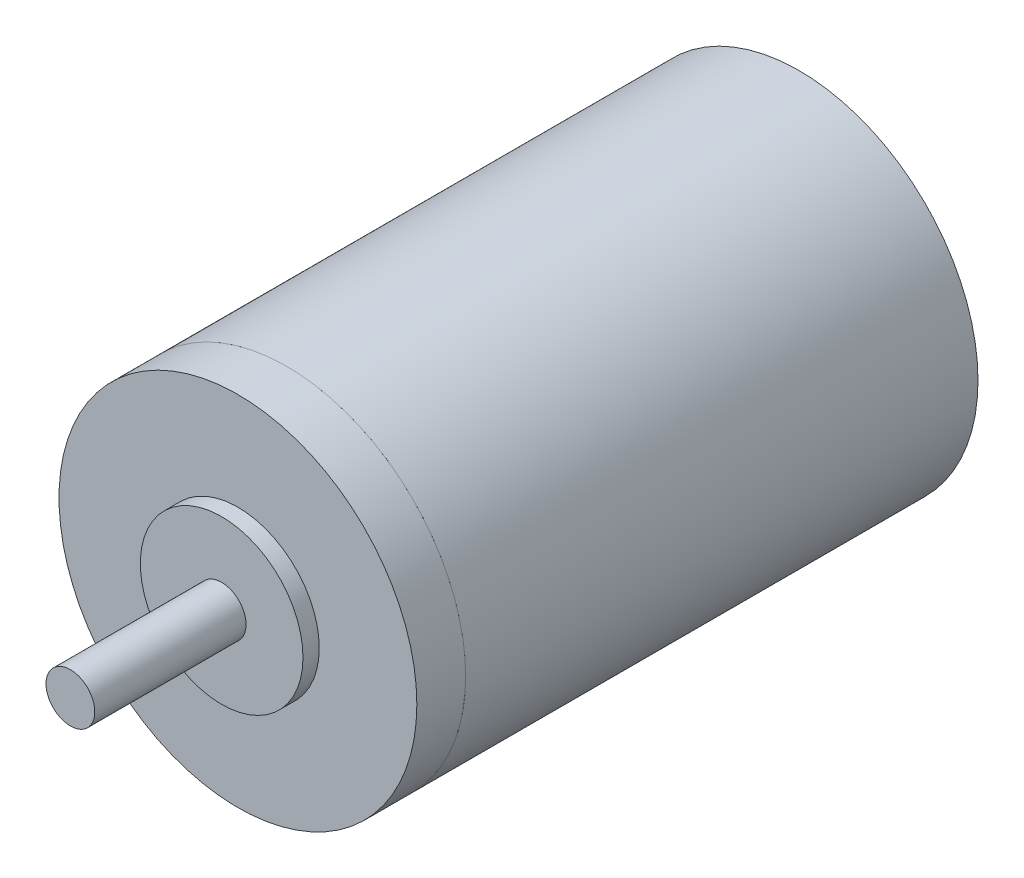
from build123d import *

# Parameters (mm, degrees)
SKETCH1_R      = 11
BODY_DEPTH     = 34.5
SKETCH1_3_R    = 5
COLLAR_DEPTH   = 1
SKETCH1_4_R    = 1.5
SHAFT_DEPTH    = 10.3
CAP_START      = -3
SKETCH2_R      = 11
SKETCH2_R_2    = 10.5
CAP_RING_DEPTH = 0.001


with BuildPart() as part:
    # Sketch1 → Body (new body)
    with BuildSketch(Plane.XY):
        Circle(SKETCH1_R)
    extrude(amount=-BODY_DEPTH)

    # Sketch1<3> → Collar (add)
    with BuildSketch(Plane.XY):
        Circle(SKETCH1_3_R)
    extrude(amount=COLLAR_DEPTH)

    # Sketch1<4> → Shaft (add)
    with BuildSketch(Plane.XY):
        Circle(SKETCH1_4_R)
    extrude(amount=SHAFT_DEPTH)

    # Sketch2 → Cap Ring (cut)
    with BuildSketch(Plane.XY.offset(CAP_START)):
        Circle(SKETCH2_R)
        Circle(SKETCH2_R_2, mode=Mode.SUBTRACT)
    extrude(amount=-CAP_RING_DEPTH, mode=Mode.SUBTRACT)


solid = part.part
